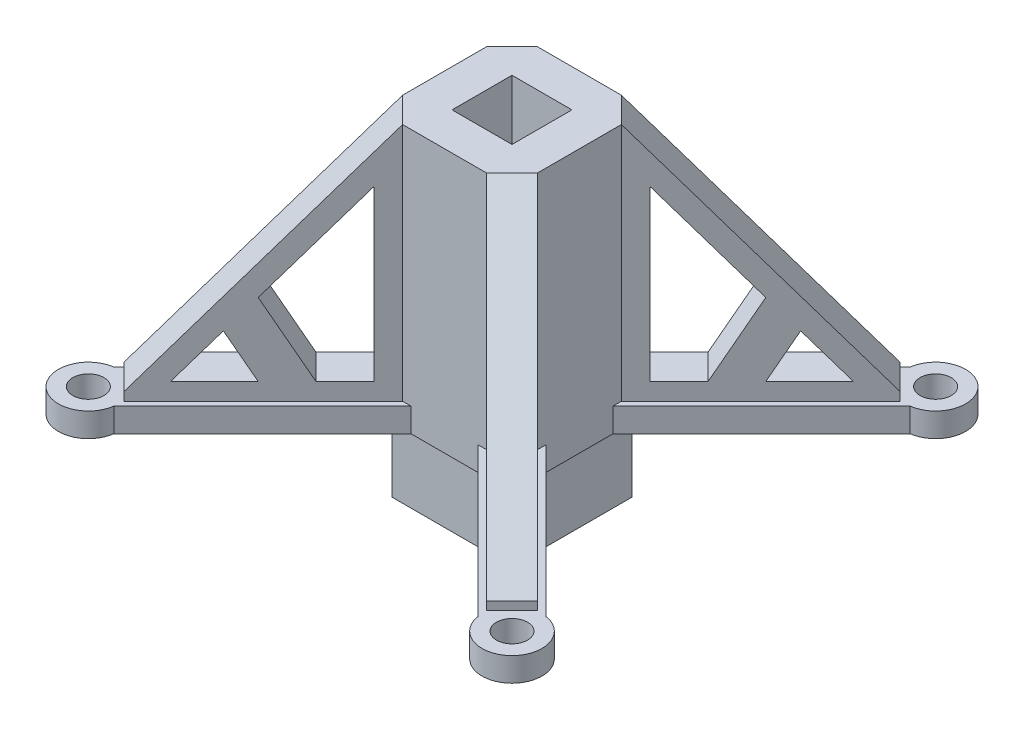
from build123d import *

# Parameters (mm, degrees)
SKETCH1_W               = 20
SKETCH1_H               = 20
BOSS_EXTRUDE2_DEPTH     = 12
BOSS_EXTRUDE3_DEPTH     = 4
SKETCH3_R               = 2.6
CUT_EXTRUDE1_DEPTH      = 7
BOSS_EXTRUDE4_DEPTH     = 40
BODY_MOVE_COPY1_ANGLE   = 45
CUT_EXTRUDE2_DEPTH      = 40
CUT_EXTRUDE2_DEPTH_BACK = 40
CUT_EXTRUDE3_DEPTH      = 40
CUT_EXTRUDE3_DEPTH_BACK = 40
CUT_EXTRUDE4_DEPTH      = 40
CUT_EXTRUDE4_DEPTH_BACK = 40
CUT_EXTRUDE7_DEPTH      = 40
CUT_EXTRUDE7_DEPTH_BACK = 40
BODY_MOVE_COPY2_ANGLE   = 45
SKETCH11_W              = 10
SKETCH11_H              = 10
CUT_EXTRUDE8_DEPTH      = 10
CUT_EXTRUDE9_DEPTH      = 17


with BuildPart() as part:
    # Sketch1 → Boss-Extrude2 (new body)
    with BuildSketch(Plane(origin=(0, 0, 0), x_dir=(1, 0, 0), z_dir=(0, 1, 0))):
        Rectangle(SKETCH1_W, SKETCH1_H)
    extrude(amount=-BOSS_EXTRUDE2_DEPTH)

    # Sketch2 → Boss-Extrude3 (add)
    with BuildSketch(Plane(origin=(0, 0, 0), x_dir=(1, 0, 0), z_dir=(0, 1, 0))):
        with BuildLine():
            Line((11.25, -5.593145751), (36.062445841, -30.405591591))
            ThreePointArc((36.062445841, -30.405591591), (38.890872965, -38.890872965), (30.405591591, -36.062445841))
            Line((30.405591591, -36.062445841), (5.593145751, -11.25))
            Line((5.593145751, -11.25), (-5.593145751, -11.25))
            Line((-5.593145751, -11.25), (-30.405591591, -36.062445841))
            ThreePointArc((-30.405591591, -36.062445841), (-38.890872965, -38.890872965), (-36.062445841, -30.405591591))
            Line((-36.062445841, -30.405591591), (-11.25, -5.593145751))
            Line((-11.25, -5.593145751), (-11.25, 5.593145751))
            Line((-11.25, 5.593145751), (-36.062445841, 30.405591591))
            ThreePointArc((-36.062445841, 30.405591591), (-38.890872965, 38.890872965), (-30.405591591, 36.062445841))
            Line((-30.405591591, 36.062445841), (-5.593145751, 11.25))
            Line((-5.593145751, 11.25), (5.593145751, 11.25))
            Line((5.593145751, 11.25), (30.405591591, 36.062445841))
            ThreePointArc((30.405591591, 36.062445841), (38.890872965, 38.890872965), (36.062445841, 30.405591591))
            Line((36.062445841, 30.405591591), (11.25, 5.593145751))
            Line((11.25, 5.593145751), (11.25, -5.593145751))
        make_face()
    extrude(amount=BOSS_EXTRUDE3_DEPTH)

    # Sketch3 → Cut-Extrude1 (cut)
    with BuildSketch(Plane(origin=(0, 0, 0), x_dir=(1, 0, 0), z_dir=(0, 1, 0))):
        with Locations(Location((-35.355339059, -35.355339059, 0), (0, 0, 270))):
            Circle(SKETCH3_R)
        with Locations(Location((-35.355339059, 35.355339059, 0), (0, 0, 270))):
            Circle(SKETCH3_R)
        with Locations(Location((35.355339059, 35.355339059, 0), (0, 0, 270))):
            Circle(SKETCH3_R)
        with Locations(Location((35.355339059, -35.355339059, 0), (0, 0, 270))):
            Circle(SKETCH3_R)
    extrude(amount=CUT_EXTRUDE1_DEPTH, mode=Mode.SUBTRACT)

    # Sketch4 → Boss-Extrude4 (add)
    with BuildSketch(Plane(origin=(0, 4, 0), x_dir=(1, 0, 0), z_dir=(0, 1, 0))):
        Polygon((-35.355339059, -31.112698372), (-31.112698372, -35.355339059), (-7.007359313, -11.25), (7.007359313, -11.25), (31.112698372, -35.355339059), (35.355339059, -31.112698372), (11.25, -7.007359313), (11.25, 7.007359313), (35.355339059, 31.112698372), (31.112698372, 35.355339059), (7.007359313, 11.25), (-7.007359313, 11.25), (-31.112698372, 35.355339059), (-35.355339059, 31.112698372), (-11.25, 7.007359313), (-11.25, -7.007359313), align=None)
    extrude(amount=BOSS_EXTRUDE4_DEPTH)


with BuildPart() as part_1:
    # Body-Move/Copy1: moved
    add(part.part.rotate(Axis((0, 0, 0), (0, 1, 0)), BODY_MOVE_COPY1_ANGLE))

    # Sketch6 → Cut-Extrude2 (cut, two sides: drawn at the far end of the back side and taken through both)
    with BuildSketch(Plane(origin=(0, 0, 0), x_dir=(0, 0, -1), z_dir=(1, 0, 0)).offset(-CUT_EXTRUDE2_DEPTH_BACK)):
        Polygon((-12.909902577, 44), (-47, 4), (-47, 44), align=None)
        Polygon((47, 44), (12.909902577, 44), (47, 4), align=None)
    extrude(amount=CUT_EXTRUDE2_DEPTH + CUT_EXTRUDE2_DEPTH_BACK, mode=Mode.SUBTRACT)

    # Sketch7 → Cut-Extrude3 (cut, two sides: drawn at the far end of the back side and taken through both)
    with BuildSketch(Plane.XY.offset(-CUT_EXTRUDE3_DEPTH_BACK)):
        Polygon((-47, 44), (-12.909902577, 44), (-47, 4), align=None)
        Polygon((47, 4), (47, 44), (12.909902577, 44), align=None)
    extrude(amount=CUT_EXTRUDE3_DEPTH + CUT_EXTRUDE3_DEPTH_BACK, mode=Mode.SUBTRACT)

    # Sketch8 → Cut-Extrude4 (cut, two sides: drawn at the far end of the back side and taken through both)
    with BuildSketch(Plane.XY.offset(-CUT_EXTRUDE4_DEPTH_BACK)):
        Polygon((-23.135931904, 6.857449794), (-29.954951288, 19), (-16.316912521, 35.002346486), (-16.316912521, 9), (-16.316912521, 6.857449794), align=None)
        Polygon((-29.954951288, 6.857449794), (-33.876748144, 13.840948819), (-34.065426963, 14.176927043), (-40.303469276, 6.857449794), align=None)
        Polygon((16.316912521, 9), (16.316912521, 35.002346486), (29.954951288, 19), (23.135931904, 6.857449794), (16.316912521, 6.857449794), align=None)
        Polygon((29.954951288, 6.857449794), (33.876748144, 13.840948819), (34.065426963, 14.176927043), (40.303469276, 6.857449794), align=None)
    extrude(amount=CUT_EXTRUDE4_DEPTH + CUT_EXTRUDE4_DEPTH_BACK, mode=Mode.SUBTRACT)

    # Sketch9 → Cut-Extrude7 (cut, two sides: drawn at the far end of the back side and taken through both)
    with BuildSketch(Plane(origin=(0, 0, 0), x_dir=(0, 0, -1), z_dir=(1, 0, 0)).offset(-CUT_EXTRUDE7_DEPTH_BACK)):
        Polygon((-23.135931904, 6.857449794), (-29.954951288, 19), (-16.316912521, 35.002346486), (-16.316912521, 9), (-16.316912521, 6.857449794), align=None)
        Polygon((-29.954951288, 6.857449794), (-33.876748144, 13.840948819), (-34.065426963, 14.176927043), (-40.303469276, 6.857449794), align=None)
        Polygon((16.316912521, 9), (16.316912521, 35.002346486), (29.954951288, 19), (23.135931904, 6.857449794), (16.316912521, 6.857449794), align=None)
        Polygon((29.954951288, 6.857449794), (33.876748144, 13.840948819), (34.065426963, 14.176927043), (40.303469276, 6.857449794), align=None)
    extrude(amount=CUT_EXTRUDE7_DEPTH + CUT_EXTRUDE7_DEPTH_BACK, mode=Mode.SUBTRACT)


with BuildPart() as part_2:
    # Body-Move/Copy2: moved
    add(part_1.part.rotate(Axis((0, 0, 0), (0, 1, 0)), BODY_MOVE_COPY2_ANGLE))

    # Sketch11 → Cut-Extrude8 (cut)
    with BuildSketch(Plane(origin=(0, 44, 0), x_dir=(1, 0, 0), z_dir=(0, 1, 0))):
        Rectangle(SKETCH11_W, SKETCH11_H)
    extrude(amount=-CUT_EXTRUDE8_DEPTH, mode=Mode.SUBTRACT)

    # Sketch12 → Cut-Extrude9 (cut)
    with BuildSketch(Plane(origin=(0, 4, 0), x_dir=(1, 0, 0), z_dir=(0, 1, 0))):
        Polygon((-35.355339059, -31.112698372), (-31.112698372, -35.355339059), (-30.264170235, -34.506810922), (-34.506810922, -30.264170235), align=None)
        Polygon((-30.264170235, 34.506810922), (-31.112698372, 35.355339059), (-35.355339059, 31.112698372), (-34.506810922, 30.264170235), align=None)
        Polygon((34.506810922, 30.264170235), (35.355339059, 31.112698372), (31.112698372, 35.355339059), (30.264170235, 34.506810922), align=None)
        Polygon((30.264170235, -34.506810922), (31.112698372, -35.355339059), (35.355339059, -31.112698372), (34.506810922, -30.264170235), align=None)
    extrude(amount=CUT_EXTRUDE9_DEPTH, mode=Mode.SUBTRACT)


solid = part_2.part
